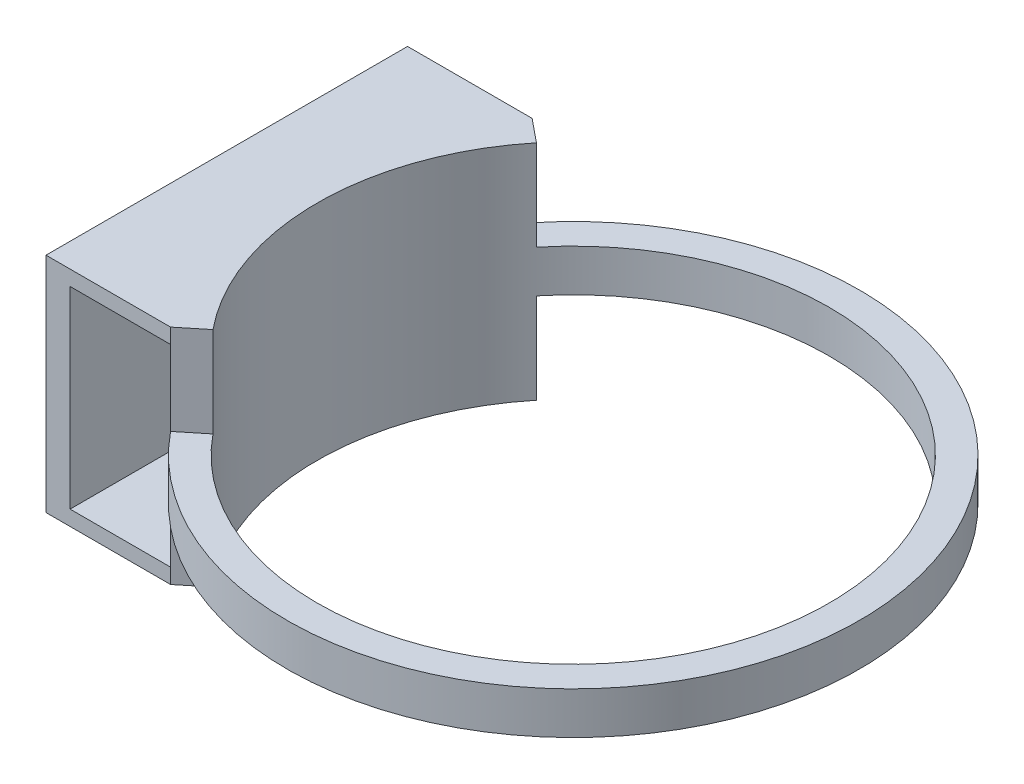
from build123d import *

# Parameters (mm, degrees)
SKETCH_1_R          = 8.5
EXTRUDE_1_DEPTH     = 0.5
SKETCH_5_R          = 9.5
SKETCH_5_R_2        = 8.5
SKETCH_5_W          = 0.8
SKETCH_5_H          = 12
EXTRUDE_4_DEPTH     = 6.4
SKETCH_6_R          = 8.5
EXTRUDE_5_DEPTH     = 0.5
CUT_EXTRUDE_START   = -3
CUT_EXTRUDE_1_DEPTH = 3
CUT_EXTRUDE_2_DEPTH = 3


with BuildPart() as part:
    # 草图1 → 凸台-拉伸1 (new body)
    with BuildSketch(Plane(origin=(0, 0, 0), x_dir=(1, 0, 0), z_dir=(0, 1, 0))):
        with BuildLine():
            Line((-11.5, 6), (-11.5, -6))
            Line((-11.5, -6), (-7.365459931, -6))
            ThreePointArc((-7.365459931, -6), (9.5, 0), (-7.365459931, 6))
            Line((-7.365459931, 6), (-11.5, 6))
        make_face()
        with Locations(Location((0, 0, 0), (0, 0, 270))):
            Circle(SKETCH_1_R, mode=Mode.SUBTRACT)
    extrude(amount=EXTRUDE_1_DEPTH)

    # 草图5 → 凸台-拉伸4 (add)
    # profile 1 of 2: a face of its own
    with BuildSketch(Plane(origin=(0, 0.5, 0), x_dir=(1, 0, 0), z_dir=(0, 1, 0))):
        with Locations(Location((0, 0, 0), (0, 0, 140.833289284))):
            Circle(SKETCH_5_R)
        with Locations(Location((0, 0, 0), (0, 0, 270))):
            Circle(SKETCH_5_R_2, mode=Mode.SUBTRACT)
    # profile 2 of 2: a face of its own
    with BuildSketch(Plane(origin=(0, 0.5, 0), x_dir=(1, 0, 0), z_dir=(0, 1, 0))):
        with Locations((-11.1, 0)):
            Rectangle(SKETCH_5_W, SKETCH_5_H)
    extrude(amount=EXTRUDE_4_DEPTH)

    # 草图6 → 凸台-拉伸5 (add)
    with BuildSketch(Plane(origin=(0, 6.9, 0), x_dir=(1, 0, 0), z_dir=(0, 1, 0))):
        with BuildLine():
            Line((-11.5, 6), (-11.5, -6))
            Line((-11.5, -6), (-7.365459931, -6))
            ThreePointArc((-7.365459931, -6), (9.5, 0), (-7.365459931, 6))
            Line((-7.365459931, 6), (-11.5, 6))
        make_face()
        with Locations(Location((0, 0, 0), (0, 0, 270))):
            Circle(SKETCH_6_R, mode=Mode.SUBTRACT)
    extrude(amount=EXTRUDE_5_DEPTH)

    # 草图7 → 切除-拉伸1 (cut)
    with BuildSketch(Plane(origin=(0, 7.4, 0), x_dir=(1, 0, 0), z_dir=(0, 1, 0)).offset(CUT_EXTRUDE_START)):
        with BuildLine():
            Line((-7.365459931, 6), (-6.59014836, 5.368421053))
            ThreePointArc((-6.59014836, 5.368421053), (8.5, 0), (-6.59014836, -5.368421053))
            Line((-6.59014836, -5.368421053), (-7.365459931, -6))
            ThreePointArc((-7.365459931, -6), (9.5, 0), (-7.365459931, 6))
        make_face()
    extrude(amount=CUT_EXTRUDE_1_DEPTH, mode=Mode.SUBTRACT)

    # 草图8 → 切除-拉伸2 (cut)
    with BuildSketch(Plane(origin=(0, 0, 0), x_dir=(-1, 0, 0), z_dir=(0, -1, 0))):
        with BuildLine():
            Line((7.365459931, -6), (6.59014836, -5.368421053))
            ThreePointArc((6.59014836, -5.368421053), (-8.5, 0), (6.59014836, 5.368421053))
            Line((6.59014836, 5.368421053), (7.365459931, 6))
            ThreePointArc((7.365459931, 6), (-9.5, 0), (7.365459931, -6))
        make_face()
    extrude(amount=-CUT_EXTRUDE_2_DEPTH, mode=Mode.SUBTRACT)


solid = part.part
